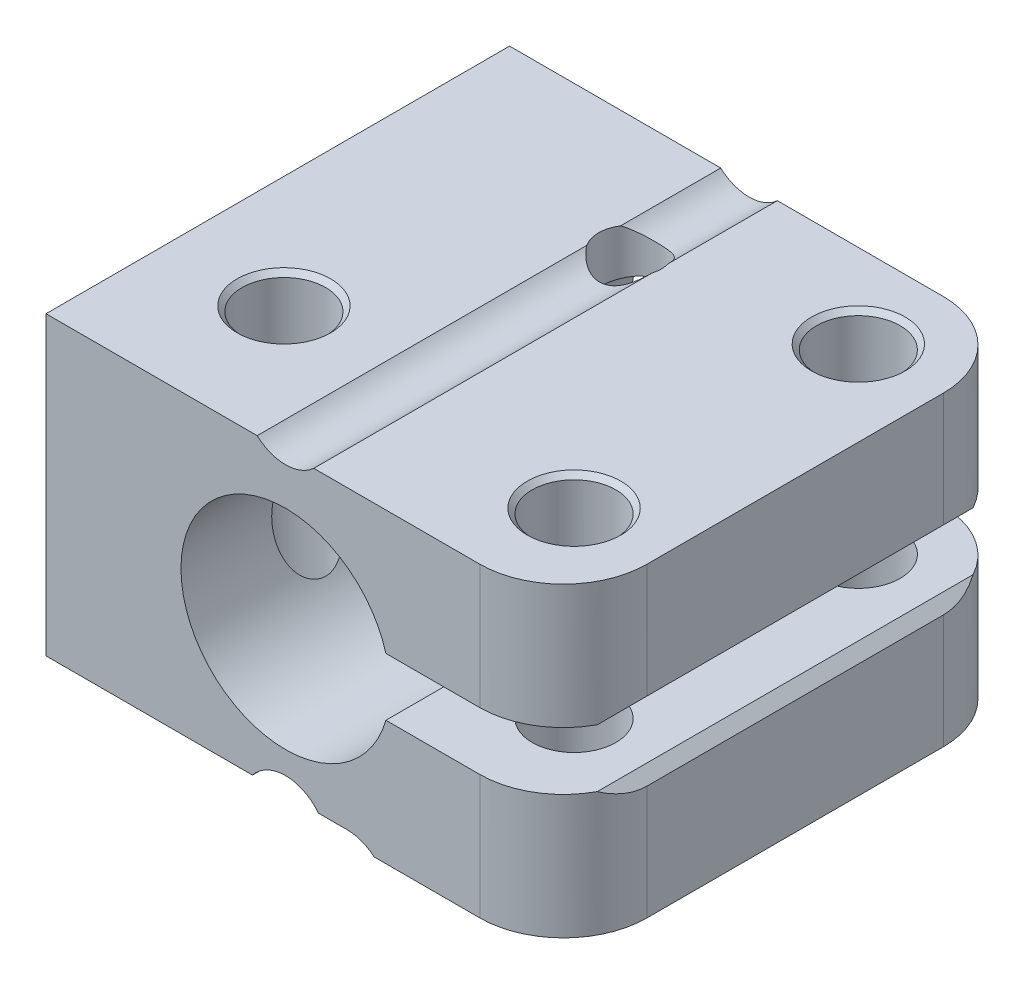
from build123d import *

# Parameters (mm, degrees)
SKETCH1_W               = 39.2938
SKETCH1_H               = 35.2044
BOSS_EXTRUDE1_DEPTH     = 23.2664
CUT_EXTRUDE1_DEPTH      = 47.54756522
SKETCH3_R               = 8.4455
CUT_EXTRUDE2_DEPTH      = 18.669
SKETCH4_R               = 3.175
SKETCH4_R_2             = 2.38125
CUT_EXTRUDE3_DEPTH      = 36.173334977
CUT_EXTRUDE4_DEPTH      = 47.547565346
CUT_EXTRUDE5_DEPTH      = 47.547565346
FILLET1_R               = 6.35
CHAMFER1_SIZE           = 0.508
CHAMFER2_SIZE           = 0.381
CUT_EXTRUDE6_DEPTH      = 36.173335093
CUT_EXTRUDE6_DEPTH_BACK = 36.173335093


with BuildPart() as part:
    # Sketch1 → Boss-Extrude1 (new body)
    with BuildSketch(Plane(origin=(0, 0, 0), x_dir=(1, 0, 0), z_dir=(0, 1, 0))):
        Rectangle(SKETCH1_W, SKETCH1_H)
    extrude(amount=BOSS_EXTRUDE1_DEPTH)

    # Sketch2 → Cut-Extrude1 (cut, through all)
    with BuildSketch(Plane(origin=(0, 0, -17.6022), x_dir=(-1, 0, 0), z_dir=(0, 0, -1))):
        with BuildLine():
            Line((-6.477, 11.6332), (-19.6469, 11.6332))
            Line((-19.6469, 11.6332), (-19.6469, 9.4361))
            Line((-19.6469, 9.4361), (-6.166862443, 9.4361))
            ThreePointArc((-6.166862443, 9.4361), (-6.399083184, 10.523759407), (-6.477, 11.6332))
        make_face()
        with BuildLine():
            Line((-19.6469, 13.8303), (-19.6469, 11.6332))
            Line((-19.6469, 11.6332), (-6.477, 11.6332))
            ThreePointArc((-6.477, 11.6332), (-6.399083184, 12.742640593), (-6.166862443, 13.8303))
            Line((-6.166862443, 13.8303), (-19.6469, 13.8303))
        make_face()
        with BuildLine():
            ThreePointArc((-6.166862443, 13.8303), (-6.399083184, 12.742640593), (-6.477, 11.6332))
            Line((-6.477, 11.6332), (9.398, 11.6332))
            ThreePointArc((9.398, 11.6332), (2.569940593, 19.492783184), (-6.166862443, 13.8303))
        make_face()
        with BuildLine():
            Line((9.398, 11.6332), (-6.477, 11.6332))
            ThreePointArc((-6.477, 11.6332), (-6.399083184, 10.523759407), (-6.166862443, 9.4361))
            ThreePointArc((-6.166862443, 9.4361), (2.569940593, 3.773616816), (9.398, 11.6332))
        make_face()
    extrude(amount=-CUT_EXTRUDE1_DEPTH, mode=Mode.SUBTRACT)

    # Sketch3 → Cut-Extrude2 (cut)
    with BuildSketch(Plane(origin=(0, 0, -17.6022), x_dir=(-1, 0, 0), z_dir=(0, 0, -1))):
        with Locations((1.4605, 11.6332)):
            Circle(SKETCH3_R)
    extrude(amount=-CUT_EXTRUDE2_DEPTH, mode=Mode.SUBTRACT)

    # Sketch4 → Cut-Extrude3 (cut, through all)
    with BuildSketch(Plane.XZ):
        with Locations(Location((13.189602751, -11.2522, 0), (0, 0, 270))):
            Circle(SKETCH4_R)
        with Locations(Location((13.189602751, 10.3378, 0), (0, 0, 270))):
            Circle(SKETCH4_R)
        with Locations(Location((-1.605897249, -8.7122, 0), (0, 0, 270))):
            Circle(SKETCH4_R_2)
        with Locations(Location((-11.130897249, 8.0518, 0), (0, 0, 270))):
            Circle(SKETCH4_R)
    extrude(amount=-CUT_EXTRUDE3_DEPTH, mode=Mode.SUBTRACT)

    # Sketch5 → Cut-Extrude4 (cut, through all)
    with BuildSketch(Plane(origin=(0, 0, -17.6022), x_dir=(-1, 0, 0), z_dir=(0, 0, -1))):
        with BuildLine():
            Line((-0.688916377, 23.2664), (3.609916377, 23.2664))
            ThreePointArc((3.609916377, 23.2664), (1.4605, 22.4282), (-0.688916377, 23.2664))
        make_face()
    extrude(amount=-CUT_EXTRUDE4_DEPTH, mode=Mode.SUBTRACT)

    # Sketch7 → Cut-Extrude5 (cut, through all)
    with BuildSketch(Plane(origin=(0, 0, -17.6022), x_dir=(-1, 0, 0), z_dir=(0, 0, -1))):
        with BuildLine():
            Line((-1.043201365, 0.762), (3.964201365, 0.762))
            ThreePointArc((3.964201365, 0.762), (1.4605, 1.984538867), (-1.043201365, 0.762))
        make_face()
        with BuildLine():
            Line((19.6469, 0), (19.6469, 0.762))
            Line((19.6469, 0.762), (3.964201365, 0.762))
            Line((3.964201365, 0.762), (-1.043201365, 0.762))
            Line((-1.043201365, 0.762), (-3.2131, 0.762))
            ThreePointArc((-3.2131, 0.762), (-4.312952263, 0.565414007), (-5.276605755, 0))
            Line((-5.276605755, 0), (19.6469, 0))
        make_face()
    extrude(amount=-CUT_EXTRUDE5_DEPTH, mode=Mode.SUBTRACT)

    # Fillet1
    fillet1_edges = [part.edges().sort_by_distance(p)[0] for p in [
        (19.6469, 4.71805, -17.6022),
        (19.6469, 4.71805, 17.6022),
        (19.6469, 18.54835, -17.6022),
        (19.6469, 18.54835, 17.6022),
    ]]
    fillet(fillet1_edges, radius=FILLET1_R)

    # Chamfer1
    chamfer1_edges = [part.edges().sort_by_distance(p)[0] for p in [
        (-9.906, 11.6332, -17.6022),
    ]]
    chamfer(chamfer1_edges, length=CHAMFER1_SIZE)

    # Chamfer2
    chamfer2_edges = [part.edges().sort_by_distance(p)[0] for p in [
        (-11.130897249, 0.762, 11.2268),
        (-11.130897249, 23.2664, 11.2268),
        (13.189602751, 23.2664, 13.5128),
        (13.189602751, 0, 13.5128),
        (13.189602751, 23.2664, -8.0772),
        (13.189602751, 0, -8.0772),
    ]]
    chamfer(chamfer2_edges, length=CHAMFER2_SIZE)

    # Sketch8 → Cut-Extrude6 (cut, two sides: drawn at the far end of the back side and taken through both)
    with BuildSketch(Plane.XY.offset(-CUT_EXTRUDE6_DEPTH_BACK)):
        Polygon((18.8849, 13.8303), (19.6469, 14.5923), (19.6469, 13.8303), align=None)
        Polygon((18.8849, 9.4361), (19.6469, 8.6741), (19.6469, 9.4361), align=None)
    extrude(amount=CUT_EXTRUDE6_DEPTH + CUT_EXTRUDE6_DEPTH_BACK, mode=Mode.SUBTRACT)


solid = part.part
